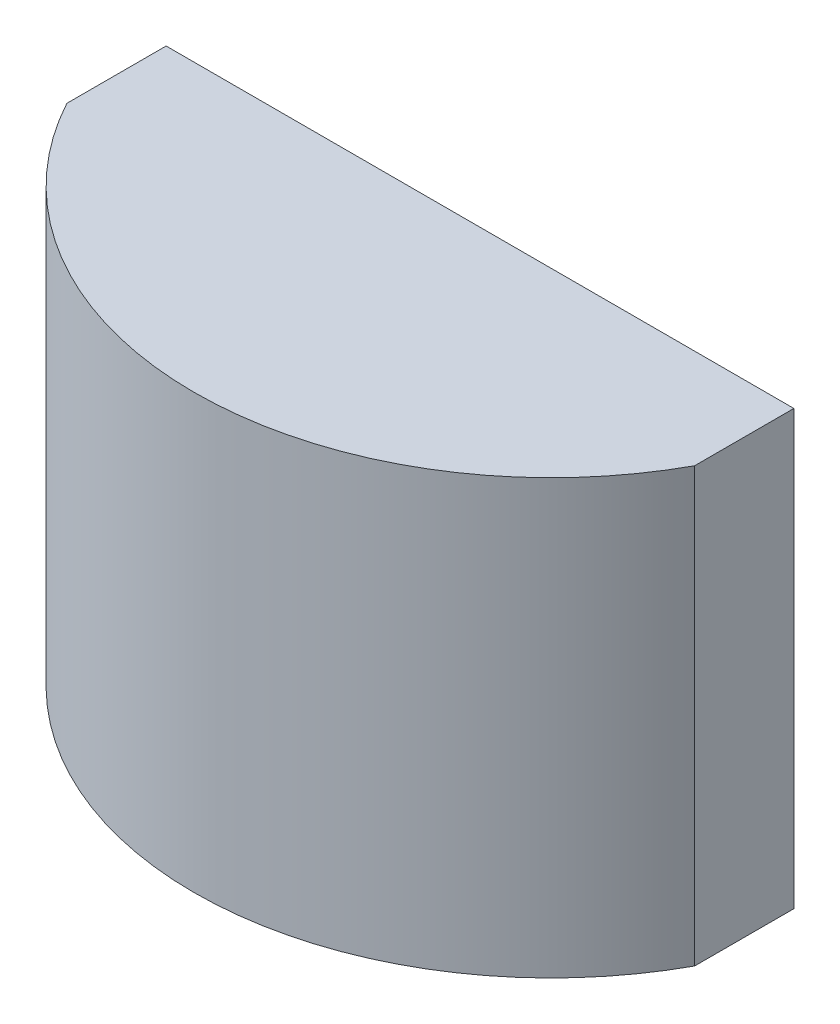
from build123d import *

# Parameters (mm, degrees)
BOSS_EXTRUDE1_DEPTH = 90


with BuildPart() as part:
    # Sketch1 → Boss-Extrude1 (new body)
    with BuildSketch(Plane(origin=(0, 0, 0), x_dir=(1, 0, 0), z_dir=(0, 1, 0))):
        with BuildLine():
            Line((65.2, -14.8), (-65.2, -14.8))
            Line((-65.2, -14.8), (-65.2, -35.420333144))
            ThreePointArc((-65.2, -35.420333144), (0, -74.2), (65.2, -35.420333144))
            Line((65.2, -35.420333144), (65.2, -14.8))
        make_face()
    extrude(amount=BOSS_EXTRUDE1_DEPTH)


solid = part.part
